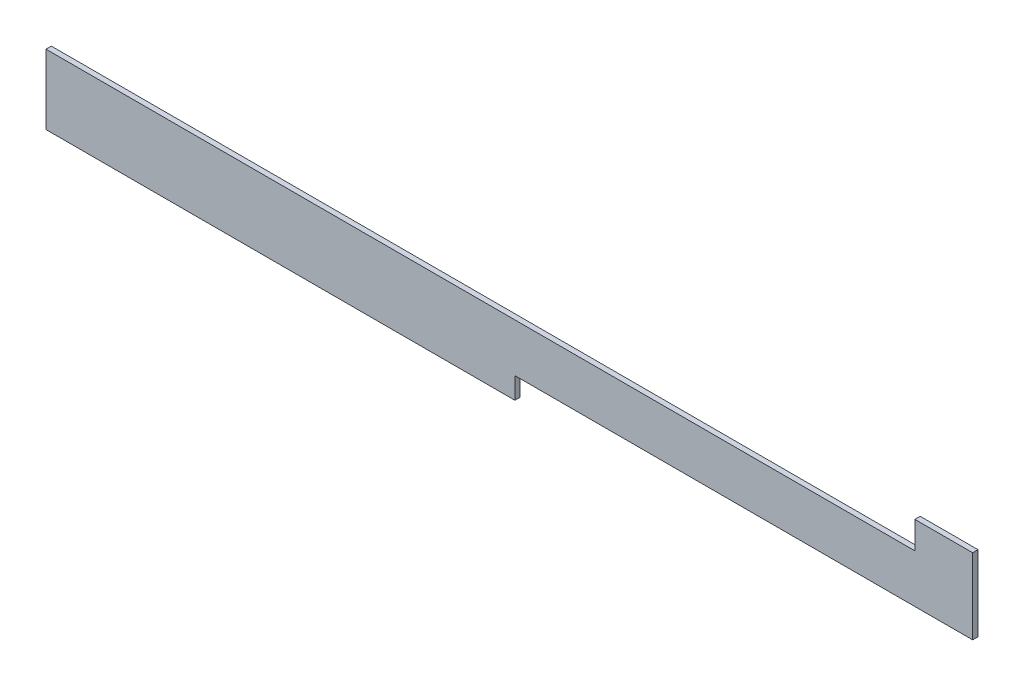
from build123d import *

# Parameters (mm, degrees)
BOSS_EXTRUDE1_DEPTH = 3.175


with BuildPart() as part:
    # Sketch1 → Boss-Extrude1 (new body)
    with BuildSketch(Plane.XY):
        Polygon((275.50364, 30.5435), (241.1095, 30.5435), (241.1095, 14.351), (-275.50364, 14.351), (-275.50364, -14.351), (-275.50364, -27.051), (3.302, -27.051), (3.302, -14.351), (241.1095, -14.351), (275.50364, -14.351), (275.50364, 14.351), align=None)
    extrude(amount=BOSS_EXTRUDE1_DEPTH)


solid = part.part
